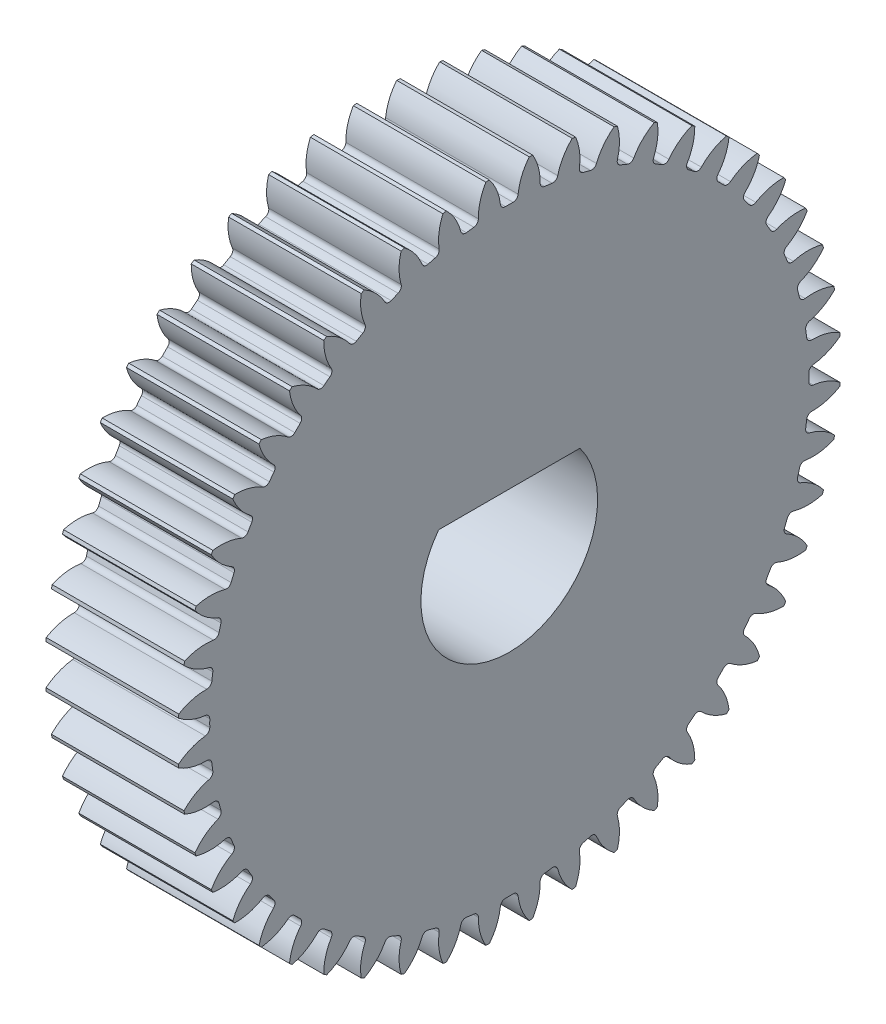
from build123d import *

# Parameters (mm, degrees)
SKETCH1_R                = 18.75
SKETCH1_R_2              = 5
BOSS_EXTRUDE2_DEPTH      = 7.5
CUT_EXTRUDE1_DEPTH       = 28.556759606
FILLET1_R                = 0.285
CIRPATTERN2_COUNT        = 48
FILLET1_OF_CIRPATTERN2_R = 0.285
BOSS_EXTRUDE3_START      = -7.5
BOSS_EXTRUDE3_DEPTH      = 7.5


with BuildPart() as part:
    # Sketch1 → Boss-Extrude2 (new body)
    with BuildSketch(Plane(origin=(0, 0, 0), x_dir=(0, 0, -1), z_dir=(1, 0, 0))):
        Circle(SKETCH1_R)
        Circle(SKETCH1_R_2, mode=Mode.SUBTRACT)
    extrude(amount=BOSS_EXTRUDE2_DEPTH)

    # Sketch3 → Cut-Extrude1 (cut, through all)
    with BuildSketch(Plane(origin=(7.5, 0, 0), x_dir=(0, 0, -1), z_dir=(1, 0, 0))):
        with BuildLine():
            ThreePointArc((0.48196481, 16.9431464), (0, 16.95), (-0.48196481, 16.9431464))
            ThreePointArc((-0.48196481, 16.9431464), (-0.661269767, 17.881787622), (-1.127261149, 18.716083519))
            ThreePointArc((-1.127261149, 18.716083519), (0, 18.75), (1.127261149, 18.716083519))
            ThreePointArc((1.127261149, 18.716083519), (0.661269767, 17.881787622), (0.48196481, 16.9431464))
        make_face()
    cut_extrude1 = extrude(amount=-CUT_EXTRUDE1_DEPTH, mode=Mode.SUBTRACT)

    # Fillet1
    fillet1_edges = [part.edges().sort_by_distance(p)[0] for p in [
        (3.75, 16.9431464, 0.48196481),
        (3.75, 16.9431464, -0.48196481),
    ]]
    fillet(fillet1_edges, radius=FILLET1_R)

    # CirPattern2: Cut-Extrude1 ×48 about axis
    cirpattern2_axis = Axis((0, 0, 0), (1, 0, 0))
    for i in range(1, CIRPATTERN2_COUNT):
        add(cut_extrude1.rotate(cirpattern2_axis, i * 360 / CIRPATTERN2_COUNT), mode=Mode.SUBTRACT)

    # Fillet1 of CirPattern2
    fillet1_of_cirpattern2_edges = [part.edges().sort_by_distance(p)[0] for p in [
        (3.75, 16.735286402, 2.689365918),
        (3.75, 16.861104465, 1.733682849),
        (3.75, 16.241081014, 4.85075123),
        (3.75, 16.490564358, 3.919666715),
        (3.75, 15.468986227, 6.929138843),
        (3.75, 15.837866123, 6.038583996),
        (3.75, 14.432212797, 8.888966969),
        (3.75, 14.914177607, 8.05417943),
        (3.75, 13.148500205, 10.696702406),
        (3.75, 13.735303378, 9.931965622),
        (3.75, 11.639813128, 12.3214143),
        (3.75, 12.3214143, 11.639813128),
        (3.75, 9.931965622, 13.735303378),
        (3.75, 10.696702406, 13.148500205),
        (3.75, 8.05417943, 14.914177607),
        (3.75, 8.888966969, 14.432212797),
        (3.75, 6.038583996, 15.837866123),
        (3.75, 6.929138843, 15.468986227),
        (3.75, 3.919666715, 16.490564358),
        (3.75, 4.85075123, 16.241081014),
        (3.75, 1.733682849, 16.861104465),
        (3.75, 2.689365918, 16.735286402),
        (3.75, -0.48196481, 16.9431464),
        (3.75, 0.48196481, 16.9431464),
        (3.75, -2.689365918, 16.735286402),
        (3.75, -1.733682849, 16.861104465),
        (3.75, -4.85075123, 16.241081014),
        (3.75, -3.919666715, 16.490564358),
        (3.75, -6.929138843, 15.468986227),
        (3.75, -6.038583996, 15.837866123),
        (3.75, -8.888966969, 14.432212797),
        (3.75, -8.05417943, 14.914177607),
        (3.75, -10.696702406, 13.148500205),
        (3.75, -9.931965622, 13.735303378),
        (3.75, -12.3214143, 11.639813128),
        (3.75, -11.639813128, 12.3214143),
        (3.75, -13.735303378, 9.931965622),
        (3.75, -13.148500205, 10.696702406),
        (3.75, -14.914177607, 8.05417943),
        (3.75, -14.432212797, 8.888966969),
        (3.75, -15.837866123, 6.038583996),
        (3.75, -15.468986227, 6.929138843),
        (3.75, -16.490564358, 3.919666715),
        (3.75, -16.241081014, 4.85075123),
        (3.75, -16.861104465, 1.733682849),
        (3.75, -16.735286402, 2.689365918),
        (3.75, -16.9431464, -0.48196481),
        (3.75, -16.9431464, 0.48196481),
        (3.75, -16.735286402, -2.689365918),
        (3.75, -16.861104465, -1.733682849),
        (3.75, -16.241081014, -4.85075123),
        (3.75, -16.490564358, -3.919666715),
        (3.75, -15.468986227, -6.929138843),
        (3.75, -15.837866123, -6.038583996),
        (3.75, -14.432212797, -8.888966969),
        (3.75, -14.914177607, -8.05417943),
        (3.75, -13.148500205, -10.696702406),
        (3.75, -13.735303378, -9.931965622),
        (3.75, -11.639813128, -12.3214143),
        (3.75, -12.3214143, -11.639813128),
        (3.75, -9.931965622, -13.735303378),
        (3.75, -10.696702406, -13.148500205),
        (3.75, -8.05417943, -14.914177607),
        (3.75, -8.888966969, -14.432212797),
        (3.75, -6.038583996, -15.837866123),
        (3.75, -6.929138843, -15.468986227),
        (3.75, -3.919666715, -16.490564358),
        (3.75, -4.85075123, -16.241081014),
        (3.75, -1.733682849, -16.861104465),
        (3.75, -2.689365918, -16.735286402),
        (3.75, 0.48196481, -16.9431464),
        (3.75, -0.48196481, -16.9431464),
        (3.75, 2.689365918, -16.735286402),
        (3.75, 1.733682849, -16.861104465),
        (3.75, 4.85075123, -16.241081014),
        (3.75, 3.919666715, -16.490564358),
        (3.75, 6.929138843, -15.468986227),
        (3.75, 6.038583996, -15.837866123),
        (3.75, 8.888966969, -14.432212797),
        (3.75, 8.05417943, -14.914177607),
        (3.75, 10.696702406, -13.148500205),
        (3.75, 9.931965622, -13.735303378),
        (3.75, 12.3214143, -11.639813128),
        (3.75, 11.639813128, -12.3214143),
        (3.75, 13.735303378, -9.931965622),
        (3.75, 13.148500205, -10.696702406),
        (3.75, 14.914177607, -8.05417943),
        (3.75, 14.432212797, -8.888966969),
        (3.75, 15.837866123, -6.038583996),
        (3.75, 15.468986227, -6.929138843),
        (3.75, 16.490564358, -3.919666715),
        (3.75, 16.241081014, -4.85075123),
        (3.75, 16.861104465, -1.733682849),
        (3.75, 16.735286402, -2.689365918),
    ]]
    fillet(fillet1_of_cirpattern2_edges, radius=FILLET1_OF_CIRPATTERN2_R)

    # Sketch4 → Boss-Extrude3 (add)
    with BuildSketch(Plane(origin=(7.5, 0, 0), x_dir=(0, 0, -1), z_dir=(1, 0, 0)).offset(BOSS_EXTRUDE3_START)):
        with BuildLine():
            Line((-4, 3), (4, 3))
            ThreePointArc((4, 3), (0, 5), (-4, 3))
        make_face()
    extrude(amount=BOSS_EXTRUDE3_DEPTH)


solid = part.part
